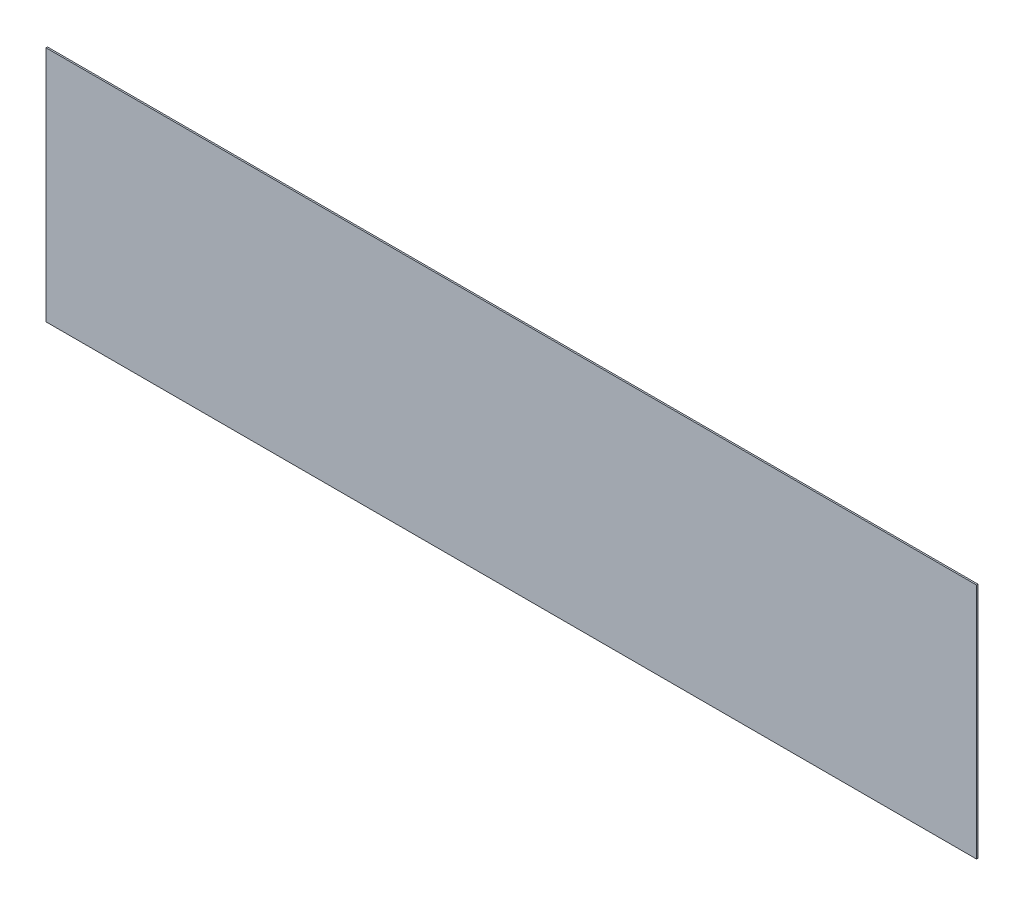
from build123d import *

# Parameters (mm, degrees)
SKETCH1_W   = 321.5
SKETCH1_H   = 82
SHEET_DEPTH = 0.511


with BuildPart() as part:
    # Sketch1 → Sheet (new body)
    with BuildSketch(Plane.XY):
        with Locations((160.75, 41)):
            Rectangle(SKETCH1_W, SKETCH1_H)
    extrude(amount=SHEET_DEPTH)


solid = part.part
